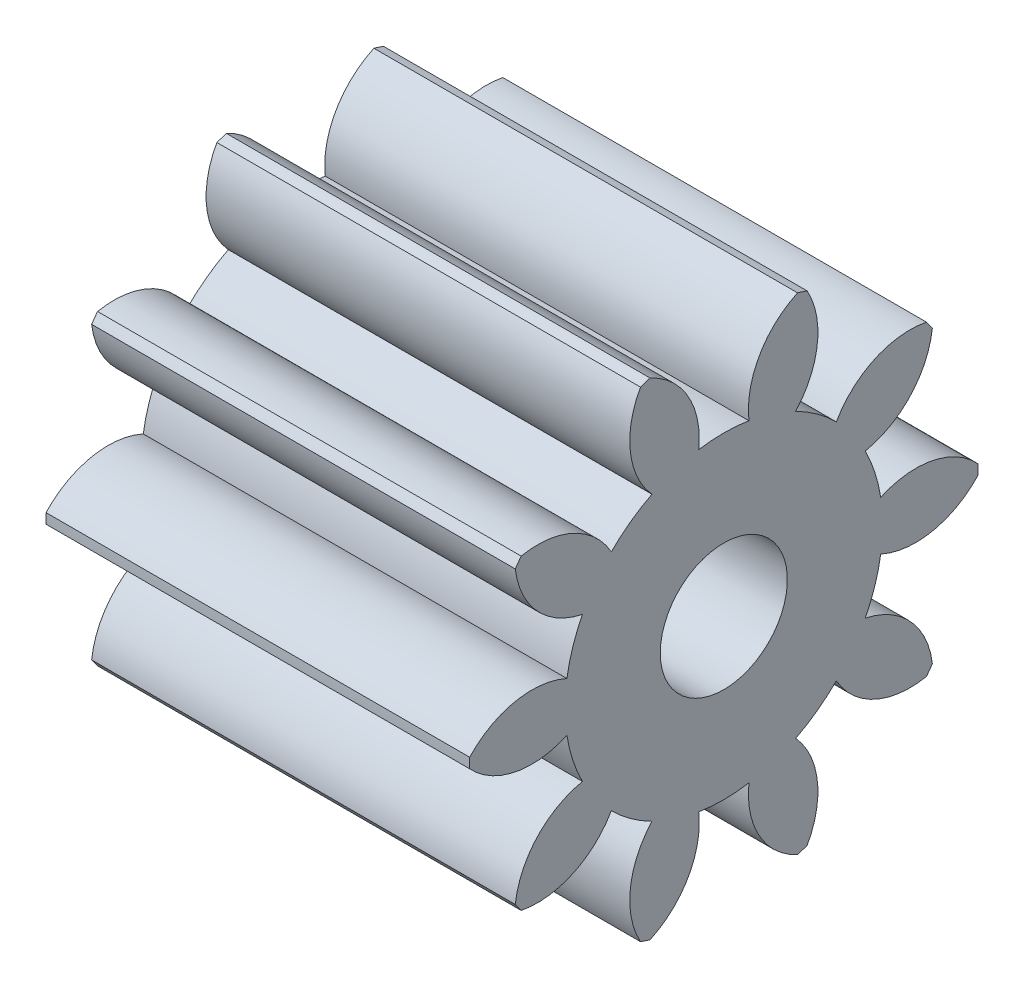
from build123d import *

# Parameters (mm, degrees)
BASPROSKE_W     = 10
BASPROSKE_H     = 6
TOOTHCUT_DEPTH  = 14.114877049
TEETHCUTS_COUNT = 10
TEETHCUTS_ANGLE = 324
BORSKE_R        = 1.5
BORE_DEPTH      = 50.0000508


with BuildPart() as part:
    # BasProSke → Base-Revolve (revolve)
    with BuildSketch(Plane(origin=(0, 0, 0), x_dir=(1, 0, 0), z_dir=(0, 1, 0)), mode=Mode.PRIVATE) as base_revolve_sk:
        with Locations((5, 3)):
            Rectangle(BASPROSKE_W, BASPROSKE_H)
    revolve(base_revolve_sk.sketch.rotate(Axis((-10, 0, 0), (1, 0, 0)), 180), axis=Axis((-10, 0, 0), (1, 0, 0)))

    # TooCutSke → ToothCut (cut, through all)
    with BuildSketch(Plane(origin=(0, 0, 0), x_dir=(0, 0, -1), z_dir=(1, 0, 0))):
        with BuildLine():
            ThreePointArc((0.59278292, 3.701838653), (0, 3.749), (-0.59278292, 3.701838653))
            ThreePointArc((-0.59278292, 3.701838653), (-0.846593509, 4.924114224), (-1.775771316, 5.757784417))
            ThreePointArc((-1.775771316, 5.757784417), (0, 6.0254), (1.775771316, 5.757784417))
            ThreePointArc((1.775771316, 5.757784417), (0.846593509, 4.924114224), (0.59278292, 3.701838653))
        make_face()
    toothcut = extrude(amount=TOOTHCUT_DEPTH, mode=Mode.SUBTRACT)

    # TeethCuts: ToothCut ×10 about axis
    teethcuts_axis = Axis((-10, 0, 0), (1, 0, 0))
    for i in range(1, TEETHCUTS_COUNT):
        add(toothcut.rotate(teethcuts_axis, i * TEETHCUTS_ANGLE / (TEETHCUTS_COUNT - 1)), mode=Mode.SUBTRACT)

    # BorSke → Bore (cut, symmetric)
    with BuildSketch(Plane(origin=(0, 0, 0), x_dir=(0, 0, -1), z_dir=(1, 0, 0))):
        with Locations(Location((0, 0, 0), (0, 0, 180))):
            Circle(BORSKE_R)
    extrude(amount=BORE_DEPTH, both=True, mode=Mode.SUBTRACT)


solid = part.part
